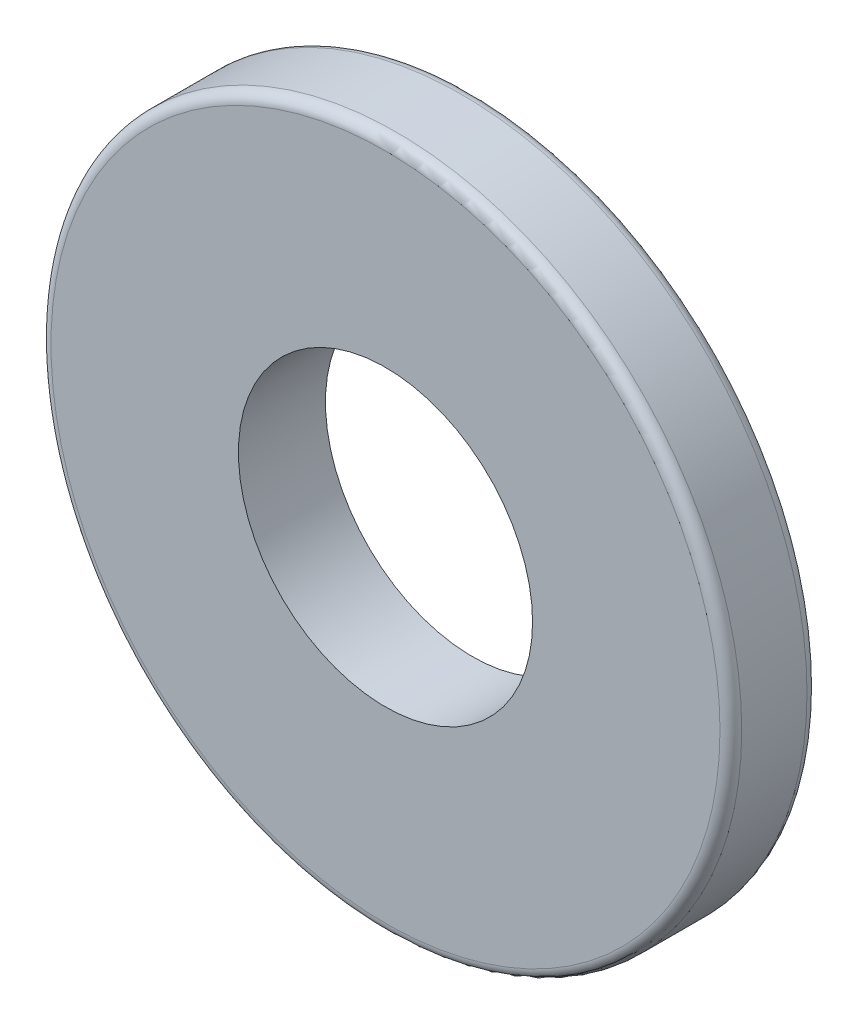
from build123d import *

# Parameters (mm, degrees)
SKETCH1_R           = 7.9375
SKETCH1_R_2         = 3.38
BOSS_EXTRUDE1_DEPTH = 2
FILLET1_R           = 0.25


with BuildPart() as part:
    # Sketch1 → Boss-Extrude1 (new body)
    with BuildSketch(Plane.XY):
        Circle(SKETCH1_R)
        Circle(SKETCH1_R_2, mode=Mode.SUBTRACT)
    extrude(amount=BOSS_EXTRUDE1_DEPTH)

    # Fillet1
    fillet1_edges = [part.edges().sort_by_distance(p)[0] for p in [
        (-7.9375, 0, 0),
        (-7.9375, 0, 2),
    ]]
    fillet(fillet1_edges, radius=FILLET1_R)


solid = part.part
